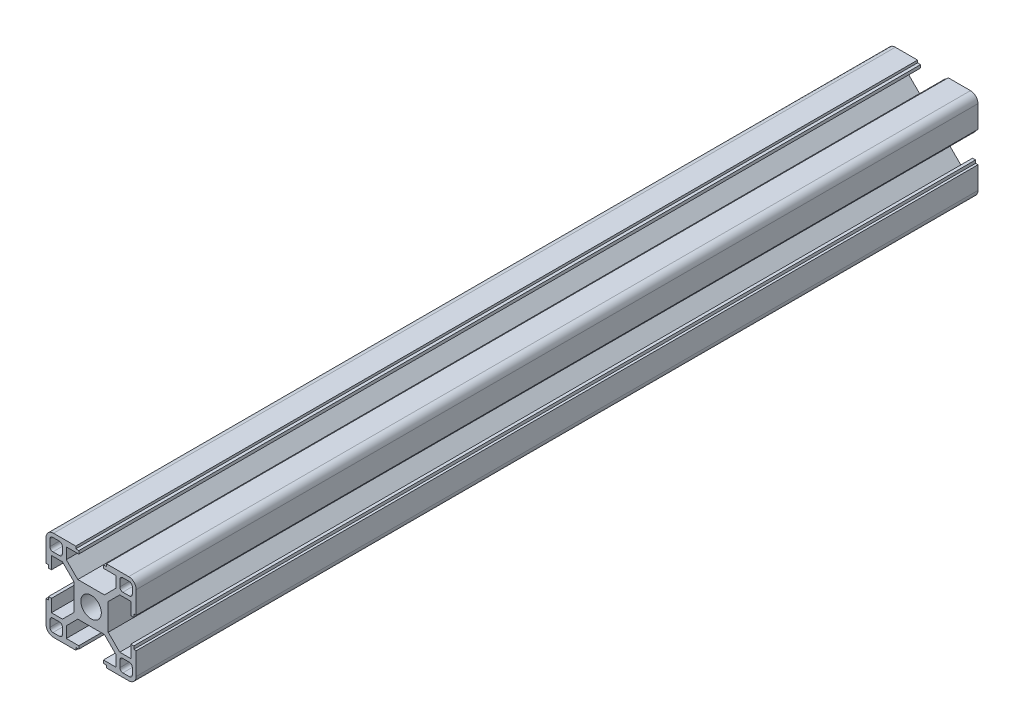
from build123d import *

# Parameters (mm, degrees)
SKETCH1_R      = 3.4
EXTRUDE1_DEPTH = 280
EXTRUDE2_DEPTH = 281.802421642


with BuildPart() as part:
    # Sketch1 → Extrude1 (new body)
    with BuildSketch(Plane.XY):
        with BuildLine():
            Line((-5.1, 14.2), (-5.1, 15))
            Line((-5.1, 15), (-12.5, 15))
            ThreePointArc((-12.5, 15), (-14.267766953, 14.267766953), (-15, 12.5))
            Line((-15, 12.5), (-15, 5.1))
            Line((-15, 5.1), (-14.2, 5.1))
            Line((-14.2, 5.1), (-14.2, 4.1))
            Line((-14.2, 4.1), (-13.2, 4.1))
            Line((-13.2, 4.1), (-13.2, 8.25))
            Line((-13.2, 8.25), (-9.522792206, 8.25))
            Line((-9.522792206, 8.25), (-5.7, 4.427207794))
            Line((-5.7, 4.427207794), (-5.7, -4.427207794))
            Line((-5.7, -4.427207794), (-9.522792206, -8.25))
            Line((-9.522792206, -8.25), (-13.2, -8.25))
            Line((-13.2, -8.25), (-13.2, -4.1))
            Line((-13.2, -4.1), (-14.2, -4.1))
            Line((-14.2, -4.1), (-14.2, -5.1))
            Line((-14.2, -5.1), (-15, -5.1))
            Line((-15, -5.1), (-15, -12.5))
            ThreePointArc((-15, -12.5), (-14.267766953, -14.267766953), (-12.5, -15))
            Line((-12.5, -15), (-5.1, -15))
            Line((-5.1, -15), (-5.1, -14.2))
            Line((-5.1, -14.2), (-4.1, -14.2))
            Line((-4.1, -14.2), (-4.1, -13.2))
            Line((-4.1, -13.2), (-8.25, -13.2))
            Line((-8.25, -13.2), (-8.25, -9.522792206))
            Line((-8.25, -9.522792206), (-4.427207794, -5.7))
            Line((-4.427207794, -5.7), (4.427207794, -5.7))
            Line((4.427207794, -5.7), (8.25, -9.522792206))
            Line((8.25, -9.522792206), (8.25, -13.2))
            Line((8.25, -13.2), (4.1, -13.2))
            Line((4.1, -13.2), (4.1, -14.2))
            Line((4.1, -14.2), (5.1, -14.2))
            Line((5.1, -14.2), (5.1, -15))
            Line((5.1, -15), (12.5, -15))
            ThreePointArc((12.5, -15), (14.267766953, -14.267766953), (15, -12.5))
            Line((15, -12.5), (15, -5.1))
            Line((15, -5.1), (14.2, -5.1))
            Line((14.2, -5.1), (14.2, -4.1))
            Line((14.2, -4.1), (13.2, -4.1))
            Line((13.2, -4.1), (13.2, -8.25))
            Line((13.2, -8.25), (9.522792206, -8.25))
            Line((9.522792206, -8.25), (5.7, -4.427207794))
            Line((5.7, -4.427207794), (5.7, 4.427207794))
            Line((5.7, 4.427207794), (9.522792206, 8.25))
            Line((9.522792206, 8.25), (13.2, 8.25))
            Line((13.2, 8.25), (13.2, 4.1))
            Line((13.2, 4.1), (14.2, 4.1))
            Line((14.2, 4.1), (14.2, 5.1))
            Line((14.2, 5.1), (15, 5.1))
            Line((15, 5.1), (15, 12.5))
            ThreePointArc((15, 12.5), (14.267766953, 14.267766953), (12.5, 15))
            Line((12.5, 15), (5.1, 15))
            Line((5.1, 15), (5.1, 14.2))
            Line((5.1, 14.2), (4.1, 14.2))
            Line((4.1, 14.2), (4.1, 13.2))
            Line((4.1, 13.2), (8.25, 13.2))
            Line((8.25, 13.2), (8.25, 9.522792206))
            Line((8.25, 9.522792206), (4.427207794, 5.7))
            Line((4.427207794, 5.7), (-4.427207794, 5.7))
            Line((-4.427207794, 5.7), (-8.25, 9.522792206))
            Line((-8.25, 9.522792206), (-8.25, 13.2))
            Line((-8.25, 13.2), (-4.1, 13.2))
            Line((-4.1, 13.2), (-4.1, 14.2))
            Line((-4.1, 14.2), (-5.1, 14.2))
        make_face()
        Circle(SKETCH1_R, mode=Mode.SUBTRACT)
    extrude(amount=EXTRUDE1_DEPTH)

    # Sketch2 → Extrude2 (cut, through all)
    with BuildSketch(Plane.XY.offset(280)):
        with BuildLine():
            Line((13.7, 12.7), (13.7, 10.55))
            ThreePointArc((13.7, 10.55), (13.407106781, 9.842893219), (12.7, 9.55))
            Line((12.7, 9.55), (10.55, 9.55))
            ThreePointArc((10.55, 9.55), (9.842893219, 9.842893219), (9.55, 10.55))
            Line((9.55, 10.55), (9.55, 12.7))
            ThreePointArc((9.55, 12.7), (9.842893219, 13.407106781), (10.55, 13.7))
            Line((10.55, 13.7), (12.7, 13.7))
            ThreePointArc((12.7, 13.7), (13.407106781, 13.407106781), (13.7, 12.7))
        make_face()
        with BuildLine():
            Line((-12.7, 13.7), (-10.55, 13.7))
            ThreePointArc((-10.55, 13.7), (-9.842893219, 13.407106781), (-9.55, 12.7))
            Line((-9.55, 12.7), (-9.55, 10.55))
            ThreePointArc((-9.55, 10.55), (-9.842893219, 9.842893219), (-10.55, 9.55))
            Line((-10.55, 9.55), (-12.7, 9.55))
            ThreePointArc((-12.7, 9.55), (-13.407106781, 9.842893219), (-13.7, 10.55))
            Line((-13.7, 10.55), (-13.7, 12.7))
            ThreePointArc((-13.7, 12.7), (-13.407106781, 13.407106781), (-12.7, 13.7))
        make_face()
        with BuildLine():
            Line((12.7, -13.7), (10.55, -13.7))
            ThreePointArc((10.55, -13.7), (9.842893219, -13.407106781), (9.55, -12.7))
            Line((9.55, -12.7), (9.55, -10.55))
            ThreePointArc((9.55, -10.55), (9.842893219, -9.842893219), (10.55, -9.55))
            Line((10.55, -9.55), (12.7, -9.55))
            ThreePointArc((12.7, -9.55), (13.407106781, -9.842893219), (13.7, -10.55))
            Line((13.7, -10.55), (13.7, -12.7))
            ThreePointArc((13.7, -12.7), (13.407106781, -13.407106781), (12.7, -13.7))
        make_face()
        with BuildLine():
            Line((-13.7, -12.7), (-13.7, -10.55))
            ThreePointArc((-13.7, -10.55), (-13.407106781, -9.842893219), (-12.7, -9.55))
            Line((-12.7, -9.55), (-10.55, -9.55))
            ThreePointArc((-10.55, -9.55), (-9.842893219, -9.842893219), (-9.55, -10.55))
            Line((-9.55, -10.55), (-9.55, -12.7))
            ThreePointArc((-9.55, -12.7), (-9.842893219, -13.407106781), (-10.55, -13.7))
            Line((-10.55, -13.7), (-12.7, -13.7))
            ThreePointArc((-12.7, -13.7), (-13.407106781, -13.407106781), (-13.7, -12.7))
        make_face()
    extrude(amount=-EXTRUDE2_DEPTH, mode=Mode.SUBTRACT)


solid = part.part
